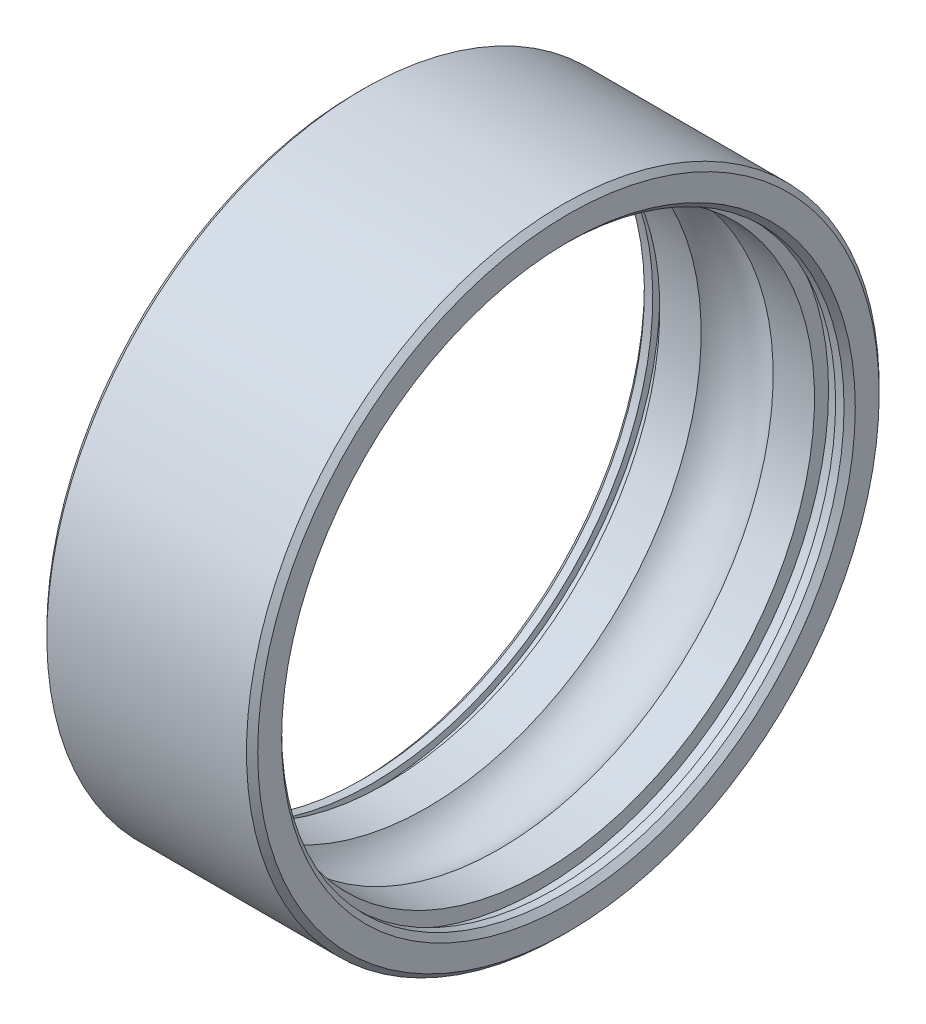
from build123d import *

# Parameters (mm, degrees)
CHAMFER1_SIZE = 0.08


with BuildPart() as part:
    # Sketch1 → Revolve1 (revolve)
    with BuildSketch(Plane.XY):
        with BuildLine():
            Line((-1.1, -3.9), (-0.512347538, -3.9))
            ThreePointArc((-0.512347538, -3.9), (0, -4.15), (0.512347538, -3.9))
            Line((0.512347538, -3.9), (1.1, -3.9))
            Line((1.1, -3.9), (1.1, -4.1))
            Line((1.1, -4.1), (1.3, -4.1))
            Line((1.3, -4.1), (1.3, -4))
            Line((1.3, -4), (1.5, -4))
            Line((1.5, -4), (1.5, -4.5))
            Line((1.5, -4.5), (-1.5, -4.5))
            Line((-1.5, -4.5), (-1.5, -4))
            Line((-1.5, -4), (-1.3, -4))
            Line((-1.3, -4), (-1.3, -4.1))
            Line((-1.3, -4.1), (-1.1, -4.1))
            Line((-1.1, -4.1), (-1.1, -3.9))
        make_face()
    revolve(axis=Axis((-6.429017492, 0, 0), (1, 0, 0)))

    # Chamfer1
    chamfer1_edges = [part.edges().sort_by_distance(p)[0] for p in [
        (1.5, 4.5, 0),
        (-1.5, 4.5, 0),
        (-1.5, 4, 0),
        (1.5, 4, 0),
    ]]
    chamfer(chamfer1_edges, length=CHAMFER1_SIZE)


solid = part.part
